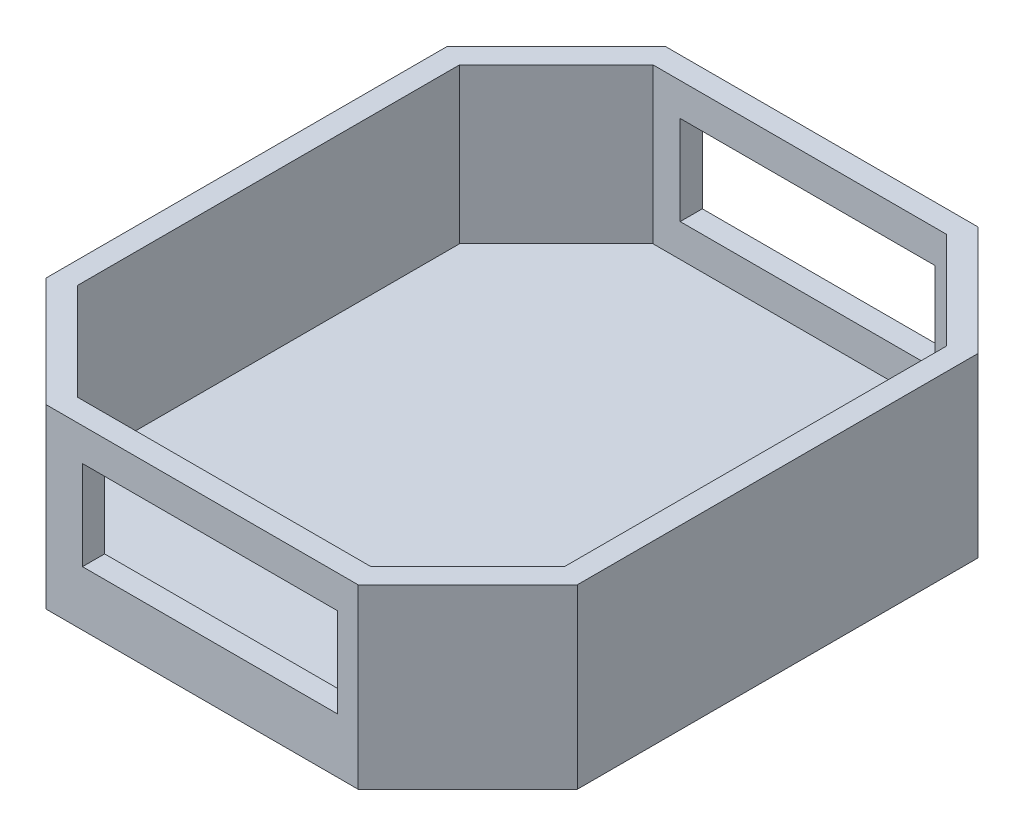
from build123d import *

# Parameters (mm, degrees)
BOSS_EXTRUDE1_DEPTH     = 101.6
SHELL1_T                = -12.7
CUT_EXTRUDE1_DEPTH      = 400.9996
CUT_EXTRUDE1_DEPTH_BACK = 400.9996
SKETCH2_W               = 146.165409225
SKETCH2_H               = 51.250950884


with BuildPart() as part:
    # Sketch1 → Boss-Extrude1 (new body)
    with BuildSketch(Plane(origin=(0, 0, 0), x_dir=(1, 0, 0), z_dir=(0, 1, 0))):
        Polygon((-89.538207153, 177.8), (-152.4, 114.938207153), (-152.4, -114.938207153), (-89.538207153, -177.8), (89.538207153, -177.8), (152.4, -114.938207153), (152.4, 114.938207153), (89.538207153, 177.8), align=None)
    extrude(amount=BOSS_EXTRUDE1_DEPTH)

    # Shell1
    shell1_openings = [part.faces().sort_by_distance(p)[0] for p in [
        (0, 101.6, 0),
    ]]
    offset(amount=SHELL1_T, openings=shell1_openings, kind=Kind.INTERSECTION)

    # Sketch2 → Cut-Extrude1 (cut, two sides: drawn at the far end of the back side and taken through both)
    with BuildSketch(Plane.XY.offset(177.8).offset(-CUT_EXTRUDE1_DEPTH_BACK)):
        with Locations((4.47129157, 57.152474053)):
            Rectangle(SKETCH2_W, SKETCH2_H)
    extrude(amount=CUT_EXTRUDE1_DEPTH + CUT_EXTRUDE1_DEPTH_BACK, mode=Mode.SUBTRACT)


solid = part.part
